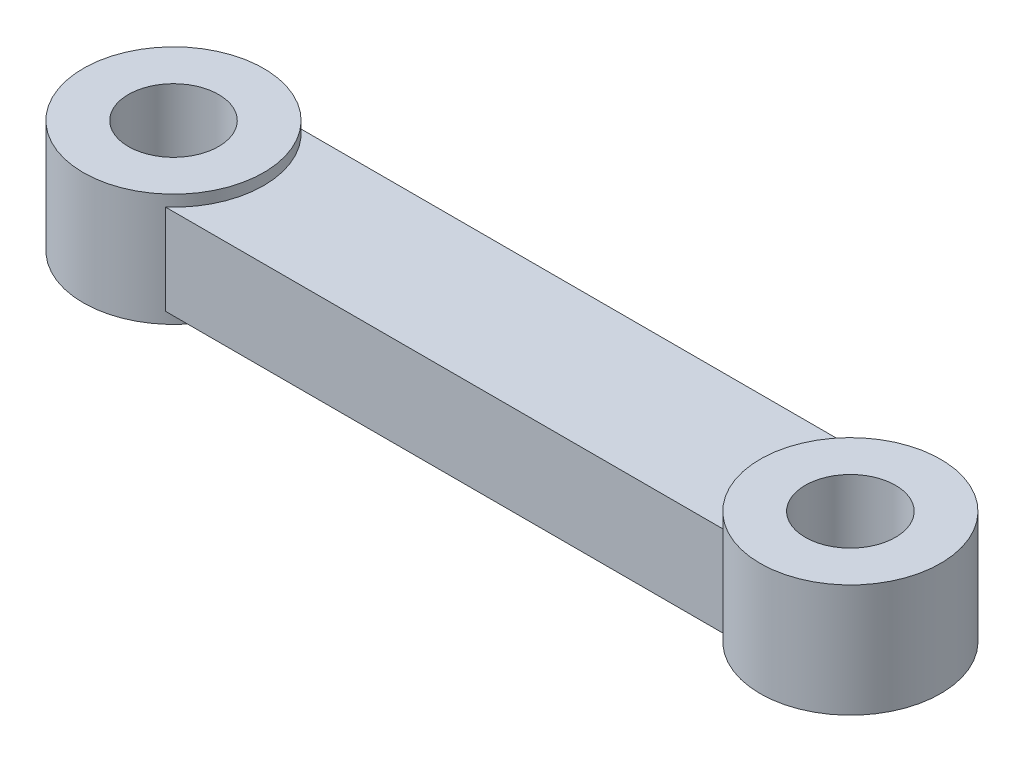
from build123d import *

# Parameters (mm, degrees)
SKETCH_1_R        = 8
SKETCH_1_R_2      = 4
EXTRUDE_1_DEPTH   = 10
EXTRUDE_1_2_DEPTH = 10
EXTRUDE_START     = 1
EXTRUDE_2_DEPTH   = 8


with BuildPart() as part:
    # 草图1 → 凸台-拉伸1 (new body)
    with BuildSketch(Plane(origin=(0, 0, 0), x_dir=(1, 0, 0), z_dir=(0, 1, 0))):
        with Locations(Location((0, 0, 0), (0, 0, 270))):
            Circle(SKETCH_1_R)
        with Locations(Location((0, 0, 0), (0, 0, 270))):
            Circle(SKETCH_1_R_2, mode=Mode.SUBTRACT)
    extrude(amount=EXTRUDE_1_DEPTH)



with BuildPart() as body_2:
    # 草图1 → Extrude 1 2 (new body)
    with BuildSketch(Plane(origin=(0, 0, 0), x_dir=(1, 0, 0), z_dir=(0, 1, 0))):
        with Locations(Location((60, 0, 0), (0, 0, 270))):
            Circle(SKETCH_1_R)
        with Locations(Location((60, 0, 0), (0, 0, 270))):
            Circle(SKETCH_1_R_2, mode=Mode.SUBTRACT)
    extrude(amount=EXTRUDE_1_2_DEPTH)


with BuildPart() as part_1:
    add(part.part)

    add(body_2.part)  # 凸台-拉伸2 merges body 2
    # 草图2 → 凸台-拉伸2 (add)
    with BuildSketch(Plane(origin=(0, 0, 0), x_dir=(1, 0, 0), z_dir=(0, 1, 0)).offset(EXTRUDE_START)):
        with BuildLine():
            Line((5.291502622, -6), (54.708497378, -6))
            ThreePointArc((54.708497378, -6), (52, 0), (54.708497378, 6))
            Line((54.708497378, 6), (5.291502622, 6))
            ThreePointArc((5.291502622, 6), (8, 0), (5.291502622, -6))
        make_face()
    extrude(amount=EXTRUDE_2_DEPTH)


solid = part_1.part
